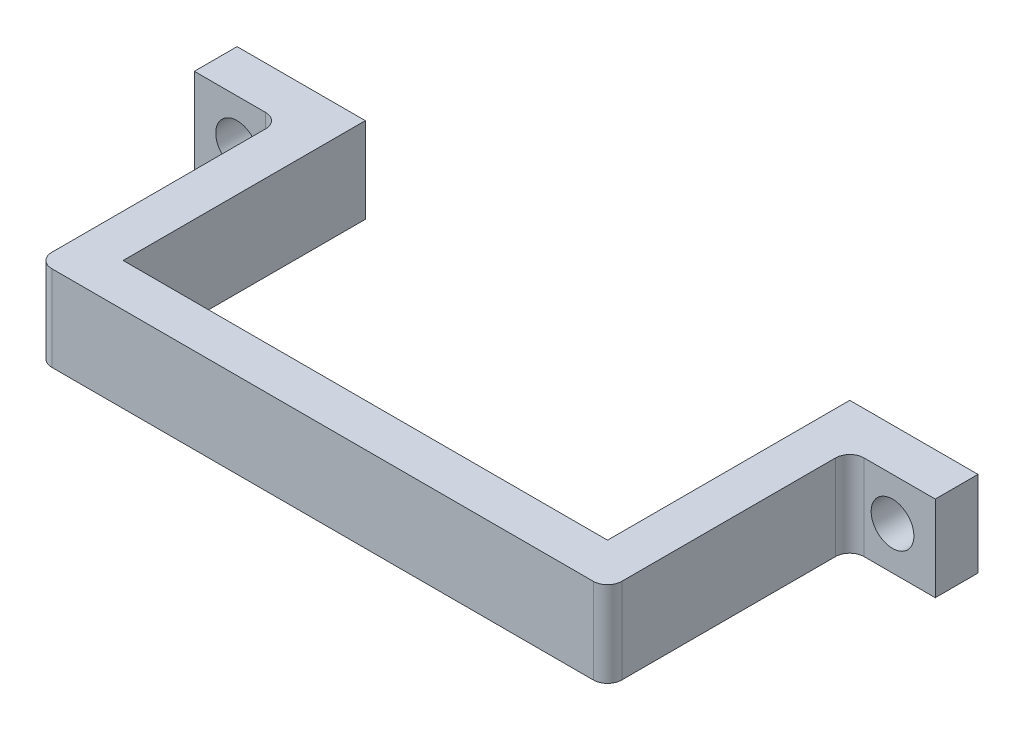
from build123d import *

# Parameters (mm, degrees)
SKETCH1_W           = 6
SKETCH1_H           = 3
SKETCH1_W_2         = 40
BOSS_EXTRUDE1_DEPTH = 6
SKETCH2_R           = 1.5
CUT_EXTRUDE1_DEPTH  = 6
FILLET1_R           = 1
FILLET2_R           = 1
FILLET3_R           = 1
FILLET4_R           = 1


with BuildPart() as part:
    # Sketch1 → Boss-Extrude1 (new body)
    with BuildSketch(Plane(origin=(0, 0, 0), x_dir=(1, 0, 0), z_dir=(0, 1, 0))):
        with Locations((-21.87164751, 17.478927203)):
            Rectangle(SKETCH1_W, SKETCH1_H)
        Polygon((-18.87164751, 15.978927203), (-18.87164751, 1.978927203), (-15.87164751, 1.978927203), (-15.87164751, 18.978927203), (-18.87164751, 18.978927203), align=None)
        with Locations((1.12835249, 0.478927203)):
            Rectangle(SKETCH1_W_2, SKETCH1_H)
        Polygon((18.12835249, 18.978927203), (18.12835249, 1.978927203), (21.12835249, 1.978927203), (21.12835249, 15.978927203), (21.12835249, 18.978927203), align=None)
        with Locations((24.12835249, 17.478927203)):
            Rectangle(SKETCH1_W, SKETCH1_H)
    extrude(amount=BOSS_EXTRUDE1_DEPTH)

    # Sketch2 → Cut-Extrude1 (cut)
    with BuildSketch(Plane.XY.offset(-15.978927203)):
        with Locations((-21.87164751, 3)):
            Circle(SKETCH2_R)
        with Locations((24.12835249, 3)):
            Circle(SKETCH2_R)
    extrude(amount=-CUT_EXTRUDE1_DEPTH, mode=Mode.SUBTRACT)

    # Fillet1
    fillet1_edges = [part.edges().sort_by_distance(p)[0] for p in [
        (-18.87164751, 3, -15.978927203),
    ]]
    fillet(fillet1_edges, radius=FILLET1_R)

    # Fillet2
    fillet2_edges = [part.edges().sort_by_distance(p)[0] for p in [
        (21.12835249, 3, -15.978927203),
    ]]
    fillet(fillet2_edges, radius=FILLET2_R)

    # Fillet3
    fillet3_edges = [part.edges().sort_by_distance(p)[0] for p in [
        (21.12835249, 3, 1.021072797),
    ]]
    fillet(fillet3_edges, radius=FILLET3_R)

    # Fillet4
    fillet4_edges = [part.edges().sort_by_distance(p)[0] for p in [
        (-18.87164751, 3, 1.021072797),
    ]]
    fillet(fillet4_edges, radius=FILLET4_R)


solid = part.part
